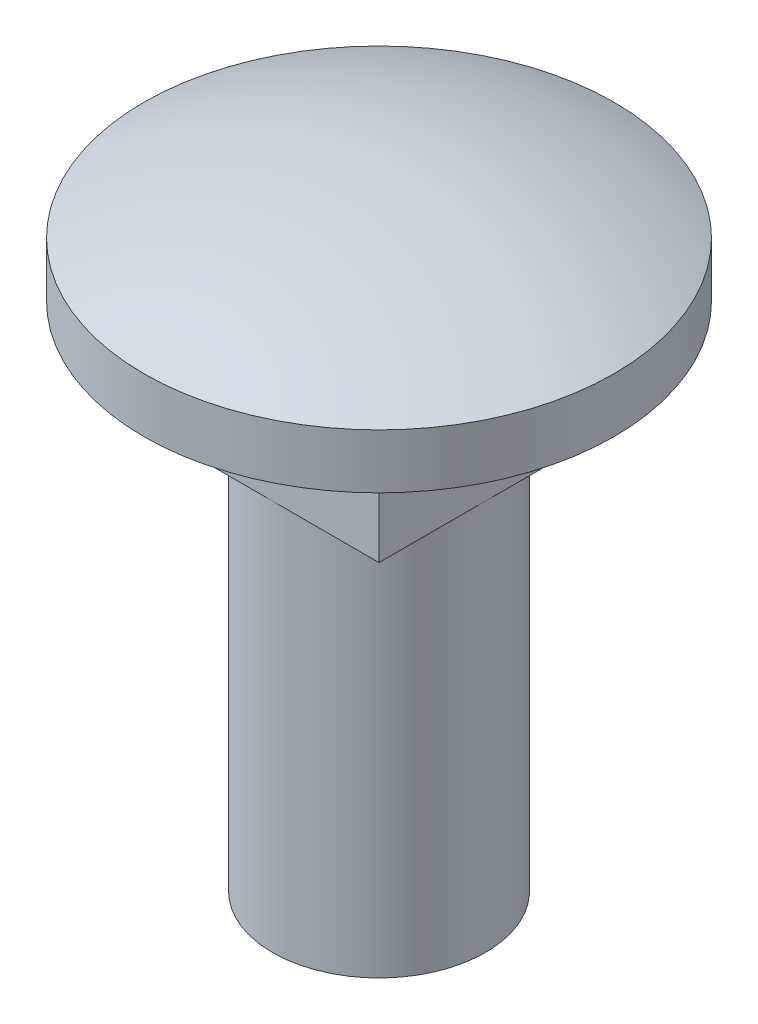
from build123d import *

# Parameters (mm, degrees)
SKETCH2_W         = 8.001
SKETCH2_H         = 8.001
SQUARE_BOSS_DEPTH = 4.445


with BuildPart() as part:
    # Sketch1 → Screw revolve (revolve)
    with BuildSketch(Plane.XY, mode=Mode.PRIVATE) as screw_revolve_sk:
        with BuildLine():
            Line((0, 0), (3.96875, 0))
            Line((3.96875, 0), (3.96875, 19.05))
            Line((3.96875, 19.05), (8.763, 19.05))
            Line((8.763, 19.05), (8.763, 21.082))
            ThreePointArc((8.763, 21.082), (4.497754801, 22.599348829), (0, 23.114))
            Line((0, 23.114), (0, 0))
        make_face()
    revolve(screw_revolve_sk.sketch.rotate(Axis((0, 0, 0), (0, 1, 0)), 90), axis=Axis((0, 0, 0), (0, 1, 0)))

    # Sketch2 → Square boss (add)
    with BuildSketch(Plane.XZ.offset(-19.05)):
        Rectangle(SKETCH2_W, SKETCH2_H)
    extrude(amount=SQUARE_BOSS_DEPTH)


solid = part.part
